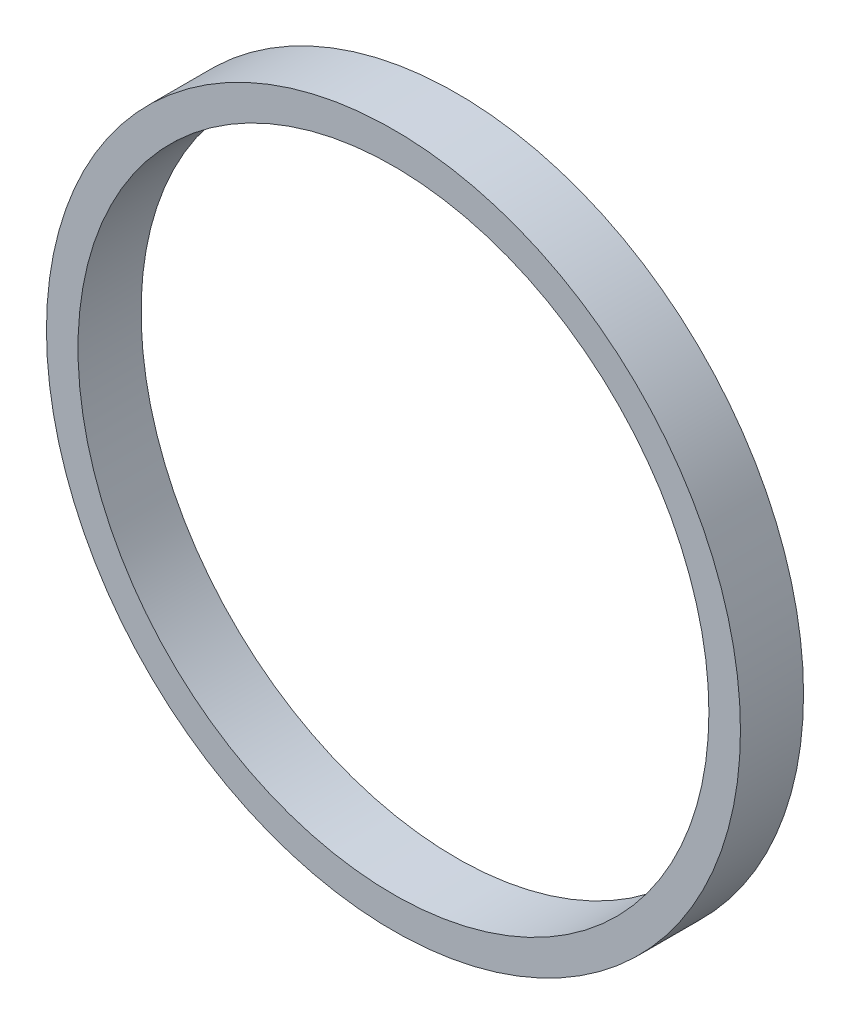
from build123d import *

# Parameters (mm, degrees)
SKETCH_1_R      = 55
SKETCH_1_R_2    = 50
EXTRUDE_1_DEPTH = 10


with BuildPart() as part:
    # 草图1 → 凸台-拉伸1 (new body)
    with BuildSketch(Plane.XY):
        Circle(SKETCH_1_R)
        Circle(SKETCH_1_R_2, mode=Mode.SUBTRACT)
    extrude(amount=EXTRUDE_1_DEPTH)


solid = part.part
